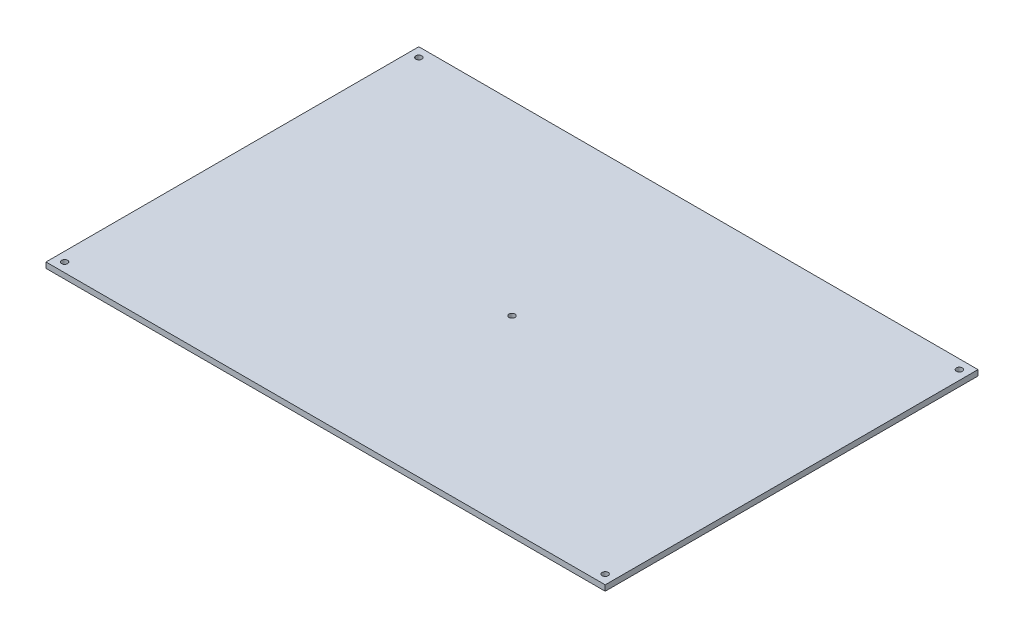
from build123d import *

# Parameters (mm, degrees)
SKETCH1_W                  = 300
SKETCH1_H                  = 200
EXTRUSION1_DEPTH           = 3
F_3_2_3_2_DIAMETER_HOLE1_D = 3.2


with BuildPart() as part:
    # Sketch1 → Extrusion1 (new body)
    with BuildSketch(Plane(origin=(0, 0, 0), x_dir=(-1, 0, 0), z_dir=(0, 1, 0))):
        Rectangle(SKETCH1_W, SKETCH1_H)
    extrude(amount=-EXTRUSION1_DEPTH)

    # Ø3.2 (3.2) Diameter Hole1 (through all)
    with Locations(Plane(origin=(0, 0, 0), x_dir=(1, 0, 0), z_dir=(0, 1, 0))):
        with Locations((-145, 95), (145, 95), (145, -95), (0, -104.5), (-145, -95), (0, 0)):
            Hole(F_3_2_3_2_DIAMETER_HOLE1_D / 2)


solid = part.part
